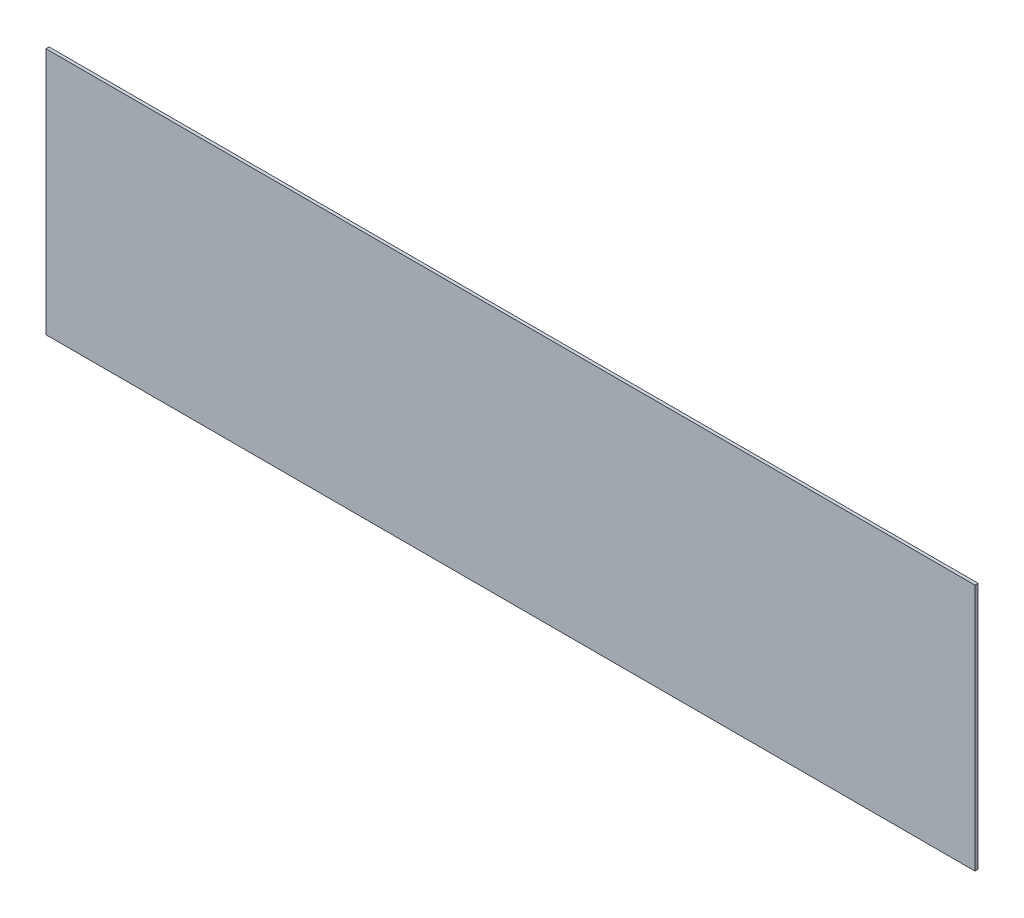
from build123d import *

# Parameters (mm, degrees)
PACK_PANO_PLAKASI_1_START = -248
SKETCH1_W                 = 600
SKETCH1_H                 = 160
PACK_PANO_PLAKASI_1_DEPTH = 2


with BuildPart() as part:
    # Sketch1 → PACK_pano_plakasi_1 (new body)
    with BuildSketch(Plane.XY.offset(PACK_PANO_PLAKASI_1_START)):
        with Locations((350, 210)):
            Rectangle(SKETCH1_W, SKETCH1_H)
    extrude(amount=-PACK_PANO_PLAKASI_1_DEPTH)


solid = part.part
